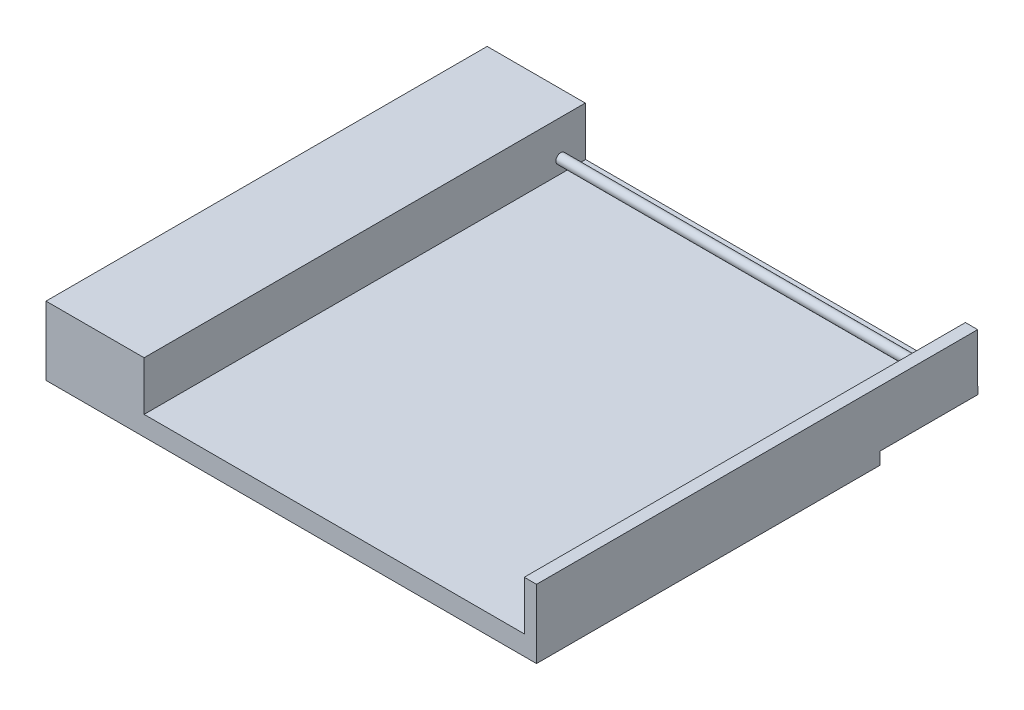
from build123d import *

# Parameters (mm, degrees)
SKETCH1_W           = 200
SKETCH1_H           = 180
BOSS_EXTRUDE1_DEPTH = 3
SKETCH2_W           = 200
SKETCH2_H           = 140
BOSS_EXTRUDE2_DEPTH = 5
SKETCH6_W           = 200
SKETCH6_H           = 179.869705491
BOSS_EXTRUDE3_DEPTH = 20
SKETCH7_W           = 155
SKETCH7_H           = 20
CUT_EXTRUDE1_DEPTH  = 179.869705491
SKETCH8_R           = 2
BOSS_EXTRUDE4_DEPTH = 155


with BuildPart() as part:
    # Sketch1 → Boss-Extrude1 (new body)
    with BuildSketch(Plane(origin=(0, 0, 0), x_dir=(1, 0, 0), z_dir=(0, 1, 0))):
        Rectangle(SKETCH1_W, SKETCH1_H)
    extrude(amount=BOSS_EXTRUDE1_DEPTH)

    # Sketch2 → Boss-Extrude2 (add)
    with BuildSketch(Plane.XZ):
        with Locations((0, 20)):
            Rectangle(SKETCH2_W, SKETCH2_H)
    extrude(amount=BOSS_EXTRUDE2_DEPTH)

    # Sketch6 → Boss-Extrude3 (add)
    with BuildSketch(Plane(origin=(0, 3, 0), x_dir=(1, 0, 0), z_dir=(0, 1, 0))):
        with Locations((0, -0.065147254)):
            Rectangle(SKETCH6_W, SKETCH6_H)
    extrude(amount=BOSS_EXTRUDE3_DEPTH)

    # Sketch7 → Cut-Extrude1 (cut)
    with BuildSketch(Plane(origin=(0, 0, -89.869705491), x_dir=(-1, 0, 0), z_dir=(0, 0, -1))):
        with Locations((-17.5, 13)):
            Rectangle(SKETCH7_W, SKETCH7_H)
    extrude(amount=-CUT_EXTRUDE1_DEPTH, mode=Mode.SUBTRACT)

    # Sketch8 → Boss-Extrude4 (add)
    with BuildSketch(Plane.ZY.offset(-95)):
        with Locations(Location((-79.869705491, 8.5, 0), (0, 0, 180))):
            Circle(SKETCH8_R)
    extrude(amount=BOSS_EXTRUDE4_DEPTH)


solid = part.part
